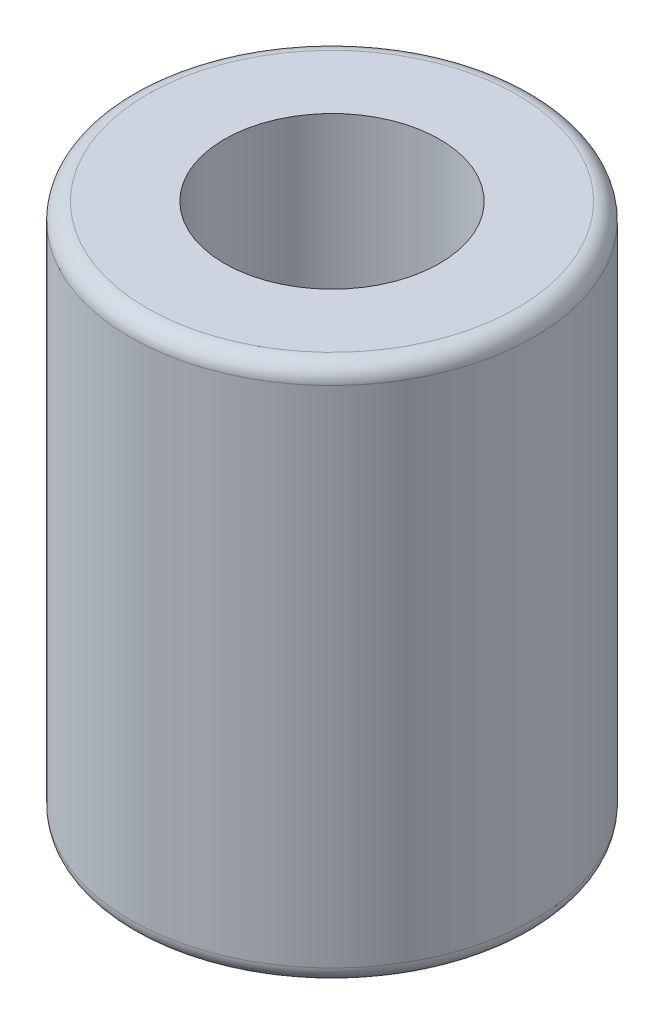
from build123d import *

# Parameters (mm, degrees)
SKETCH1_R           = 3
SKETCH1_R_2         = 1.6
BOSS_EXTRUDE1_DEPTH = 8
FILLET1_R           = 0.25


with BuildPart() as part:
    # Sketch1 → Boss-Extrude1 (new body)
    with BuildSketch(Plane(origin=(0, 0, 0), x_dir=(1, 0, 0), z_dir=(0, 1, 0))):
        with Locations(Location((0, 0, 0), (0, 0, 270))):
            Circle(SKETCH1_R)
        with Locations(Location((0, 0, 0), (0, 0, 270))):
            Circle(SKETCH1_R_2, mode=Mode.SUBTRACT)
    extrude(amount=BOSS_EXTRUDE1_DEPTH)

    # Fillet1
    fillet1_edges = [part.edges().sort_by_distance(p)[0] for p in [
        (0, 0, -3),
        (0, 8, -3),
    ]]
    fillet(fillet1_edges, radius=FILLET1_R)


solid = part.part
